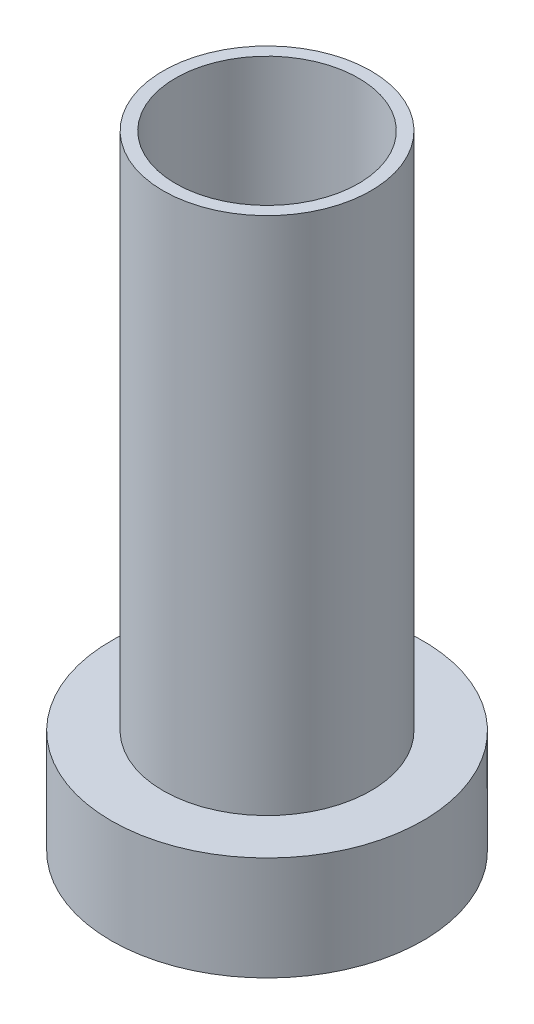
from build123d import *

# Parameters (mm, degrees)
SKETCH2_R           = 0.75
SKETCH2_R_2         = 0.5
SKETCH2_R_3         = 0.44
SKETCH2_R_4         = 0.315
BOSS_EXTRUDE1_DEPTH = 0.5
BOSS_EXTRUDE2_START = 0.5
SKETCH2_3_R         = 0.5
SKETCH2_3_R_2       = 0.44
BOSS_EXTRUDE2_DEPTH = 2.5


with BuildPart() as part:
    # Sketch2 → Boss-Extrude1 (new body)
    # profile 1 of 3: a face of its own
    with BuildSketch(Plane(origin=(0, 0, 0), x_dir=(1, 0, 0), z_dir=(0, 1, 0))):
        with Locations(Location((0, 0, 0), (0, 0, 270))):
            Circle(SKETCH2_R)
        Circle(SKETCH2_R_2, mode=Mode.SUBTRACT)
    # profile 2 of 3: a face of its own
    with BuildSketch(Plane(origin=(0, 0, 0), x_dir=(1, 0, 0), z_dir=(0, 1, 0))):
        Circle(SKETCH2_R_2)
        Circle(SKETCH2_R_3, mode=Mode.SUBTRACT)
    # profile 3 of 3: a face of its own
    with BuildSketch(Plane(origin=(0, 0, 0), x_dir=(1, 0, 0), z_dir=(0, 1, 0))):
        Circle(SKETCH2_R_3)
        with Locations(Location((0, 0, 0), (0, 0, 270))):
            Circle(SKETCH2_R_4, mode=Mode.SUBTRACT)
    extrude(amount=BOSS_EXTRUDE1_DEPTH)

    # Sketch2<3> → Boss-Extrude2 (add)
    with BuildSketch(Plane(origin=(0, 0, 0), x_dir=(1, 0, 0), z_dir=(0, 1, 0)).offset(BOSS_EXTRUDE2_START)):
        with Locations(Location((0, 0, 0), (0, 0, 270))):
            Circle(SKETCH2_3_R)
        with Locations(Location((0, 0, 0), (0, 0, 270))):
            Circle(SKETCH2_3_R_2, mode=Mode.SUBTRACT)
    extrude(amount=BOSS_EXTRUDE2_DEPTH)


solid = part.part
